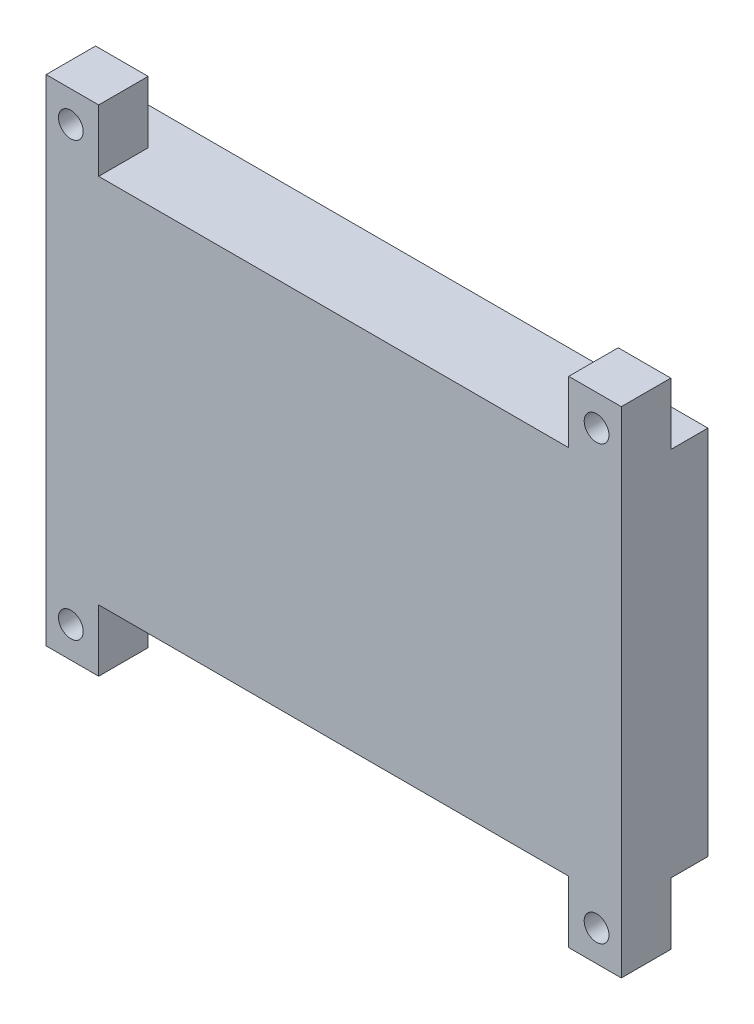
from build123d import *

# Parameters (mm, degrees)
SKETCH_3_W          = 93
SKETCH_3_H          = 60
EXTRUDE_1_DEPTH     = 6
SKETCH_6_W          = 93
SKETCH_6_H          = 80
EXTRUDE_3_DEPTH     = 8
SKETCH_7_W          = 76
SKETCH_7_H          = 10
CUT_EXTRUDE_1_DEPTH = 8
SKETCH_8_R          = 2
CUT_EXTRUDE_2_DEPTH = 8


with BuildPart() as part:
    # 草图3 → 凸台-拉伸1 (new body)
    with BuildSketch(Plane.XY):
        Rectangle(SKETCH_3_W, SKETCH_3_H)
    extrude(amount=EXTRUDE_1_DEPTH)

    # 草图6 → 凸台-拉伸3 (add)
    with BuildSketch(Plane.XY.offset(6)):
        Rectangle(SKETCH_6_W, SKETCH_6_H)
    extrude(amount=EXTRUDE_3_DEPTH)

    # 草图7 → 切除-拉伸1 (cut)
    with BuildSketch(Plane(origin=(0, 0, 6), x_dir=(-1, 0, 0), z_dir=(0, 0, -1))):
        with Locations((0, 35)):
            Rectangle(SKETCH_7_W, SKETCH_7_H)
        with Locations((0, -35)):
            Rectangle(SKETCH_7_W, SKETCH_7_H)
    extrude(amount=-CUT_EXTRUDE_1_DEPTH, mode=Mode.SUBTRACT)

    # 草图8 → 切除-拉伸2 (cut)
    with BuildSketch(Plane(origin=(0, 0, 6), x_dir=(-1, 0, 0), z_dir=(0, 0, -1))):
        with Locations((-42.5, 35)):
            Circle(SKETCH_8_R)
        with Locations(Location((42.5, 35, 0), (0, 0, 180))):
            Circle(SKETCH_8_R)
        with Locations((42.5, -35)):
            Circle(SKETCH_8_R)
        with Locations(Location((-42.5, -35, 0), (0, 0, 180))):
            Circle(SKETCH_8_R)
    extrude(amount=-CUT_EXTRUDE_2_DEPTH, mode=Mode.SUBTRACT)


solid = part.part
